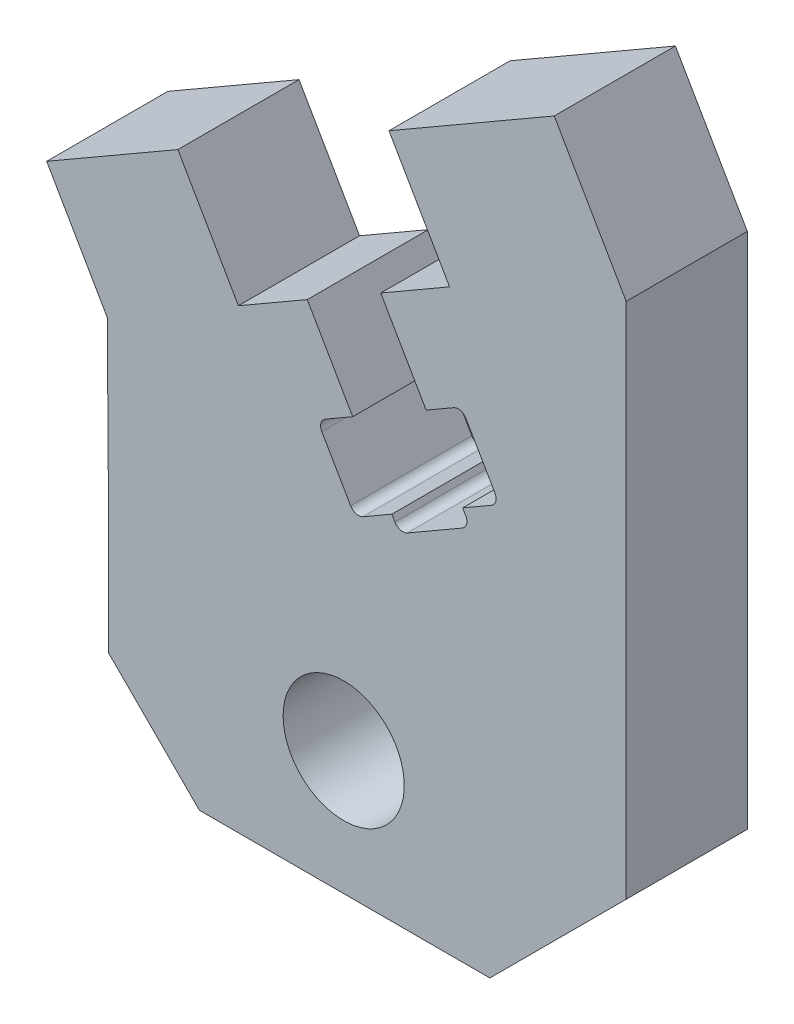
from build123d import *

# Parameters (mm, degrees)
EXTRUDE_1_DEPTH      = 4
SKETCH_3_W           = 15.588457268
SKETCH_3_H           = 4
EXTRUDE_3_DEPTH      = 2
SKETCH_19_W          = 15.588457268
SKETCH_19_H          = 4
EXTRUDE_5_DEPTH      = 5
SKETCH_4_W           = 5
SKETCH_4_H           = 4
EXTRUDE_6_DEPTH      = 5
SKETCH_22_R          = 2
CUT_EXTRUDE_17_DEPTH = 150
CHAMFER_1_SIZE       = 3
EXTRUDE_7_DEPTH      = 4
SKETCH_27_W          = 5
SKETCH_27_H          = 4
SKETCH_27_W_2        = 6.299038106
CUT_EXTRUDE_19_DEPTH = 1
CUT_EXTRUDE_22_DEPTH = 5


with BuildPart() as part:
    # 草图1 → 凸台-拉伸1 (new body)
    with BuildSketch(Plane.XY):
        Polygon((-111.620742166, 100.372452405), (-127.209199434, 100.372452405), (-127.251564891, 105.942182287), (-111.620742166, 114.966641994), align=None)
    extrude(amount=EXTRUDE_1_DEPTH)

    # 草图3 → 凸台-拉伸3 (add)
    with BuildSketch(Plane.XZ.offset(-100.372452405)):
        with Locations((-119.4149708, 2)):
            Rectangle(SKETCH_3_W, SKETCH_3_H)
    extrude(amount=EXTRUDE_3_DEPTH)

    # 草图19 → 凸台-拉伸5 (add)
    with BuildSketch(Plane.XZ.offset(-98.372452405)):
        with Locations((-119.4149708, 2)):
            Rectangle(SKETCH_19_W, SKETCH_19_H)
    extrude(amount=EXTRUDE_5_DEPTH)

    # 草图4 → 凸台-拉伸6 (add)
    with BuildSketch(Plane(origin=(-77.687201819, 134.558180648, 0), x_dir=(0.8660254037844398, 0.49999999999999806, 0), z_dir=(-0.499999999999998, 0.8660254037844397, 0))):
        with Locations((-54.731996723, -2)):
            Rectangle(SKETCH_4_W, SKETCH_4_H)
        with Locations((-41.683077308, -2)):
            Rectangle(SKETCH_4_W, SKETCH_4_H)
    extrude(amount=EXTRUDE_6_DEPTH)

    # 草图22 → 切除-拉伸17 (cut)
    with BuildSketch(Plane(origin=(0.801824419, -4.558538123, 5), x_dir=(0.9999710727819138, 0.007606155361845765, 0), z_dir=(0, 0, 1))):
        with Locations(Location((-119.468439353, 102.928528754, 0), (0, 0, 179.564195197))):
            Circle(SKETCH_22_R)
    extrude(amount=-CUT_EXTRUDE_17_DEPTH, mode=Mode.SUBTRACT)

    # 倒角1
    chamfer_1_edges = [part.edges().sort_by_distance(p)[0] for p in [
        (-127.209199434, 93.372452405, 2),
        (-111.620742166, 93.372452405, 2),
    ]]
    chamfer(chamfer_1_edges, length=CHAMFER_1_SIZE)

    # 草图25 → 凸台-拉伸7 (add)
    with BuildSketch(Plane(origin=(0, 0, 0), x_dir=(-1, 0, 0), z_dir=(0, 0, -1))):
        Polygon((111.620742166, 96.372452405), (111.620742166, 114.966641994), (114.120742166, 119.296769013), (112.995742166, 119.946288066), (110.120742166, 114.966641994), (110.120742166, 97.872452405), align=None)
    extrude(amount=-EXTRUDE_7_DEPTH)

    # 草图27 → 切除-拉伸19 (cut)
    with BuildSketch(Plane(origin=(-80.187201819, 138.888307667, 0), x_dir=(0.8660254037844395, 0.4999999999999986, 0), z_dir=(-0.4999999999999986, 0.8660254037844395, 0))):
        with Locations((-54.731996723, -2)):
            Rectangle(SKETCH_27_W, SKETCH_27_H)
        with Locations((-41.033558255, -2)):
            Rectangle(SKETCH_27_W_2, SKETCH_27_H)
    extrude(amount=-CUT_EXTRUDE_19_DEPTH, mode=Mode.SUBTRACT)

    # 草图30 → 切除-拉伸22 (cut)
    with BuildSketch(Plane(origin=(0.801824419, -4.558538123, 0), x_dir=(-0.9999710727819139, -0.007606155361845766, 0), z_dir=(0, 0, -1))):
        with BuildLine():
            Line((116.661773389, 114.005519488), (117.895269421, 116.180028062))
            Line((117.895269421, 116.180028062), (118.865299077, 117.929039916))
            Line((118.865299077, 117.929039916), (121.330841562, 116.561611031))
            Line((121.330841562, 116.561611031), (120.330719024, 114.798512507))
            Line((120.330719024, 114.798512507), (119.097222993, 112.624003932))
            Line((119.097222993, 112.624003932), (120.010516594, 112.105935599))
            ThreePointArc((120.010516594, 112.105935599), (120.15167585, 111.924842132), (120.123438099, 111.696975046))
            Line((120.123438099, 111.696975046), (119.185981115, 110.04434853))
            ThreePointArc((119.185981115, 110.04434853), (119.004887648, 109.903189273), (118.777020562, 109.931427025))
            Line((118.777020562, 109.931427025), (117.82023679, 110.474165279))
            Line((117.82023679, 110.474165279), (117.721557107, 110.300204593))
            ThreePointArc((117.721557107, 110.300204593), (117.54046364, 110.159045336), (117.312596554, 110.187283087))
            Line((117.312596554, 110.187283087), (115.486009352, 111.223419754))
            ThreePointArc((115.486009352, 111.223419754), (115.344850096, 111.404513221), (115.373087847, 111.632380307))
            Line((115.373087847, 111.632380307), (115.471767529, 111.806340993))
            Line((115.471767529, 111.806340993), (114.514983756, 112.349079246))
            ThreePointArc((114.514983756, 112.349079246), (114.3738245, 112.530172713), (114.402062251, 112.758039799))
            Line((114.402062251, 112.758039799), (115.339519235, 114.410666316))
            ThreePointArc((115.339519235, 114.410666316), (115.520612702, 114.551825572), (115.748479788, 114.523587821))
            Line((115.748479788, 114.523587821), (116.661773389, 114.005519488))
        make_face()
    extrude(amount=-CUT_EXTRUDE_22_DEPTH, mode=Mode.SUBTRACT)


solid = part.part
